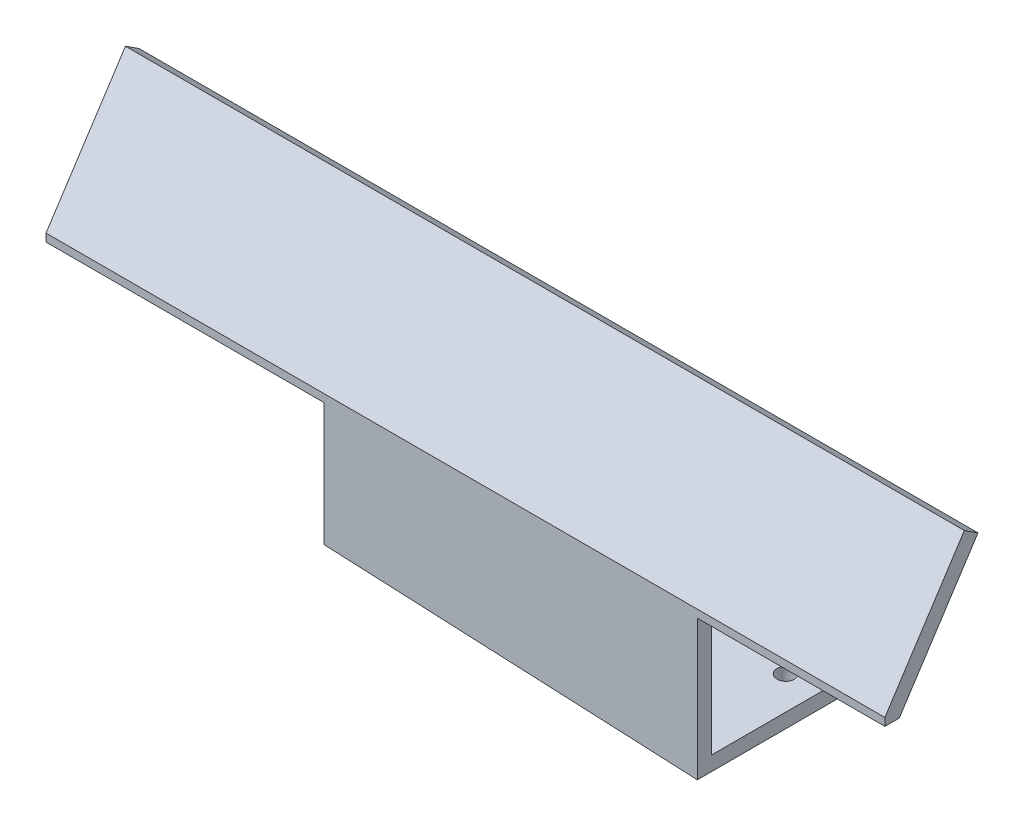
from build123d import *

# Parameters (mm, degrees)
BOSS_EXTRUDE1_DEPTH     = 175
BOSS_EXTRUDE2_DEPTH     = 3
SKETCH3_W               = 175.182761709
SKETCH3_H               = 30
BOSS_EXTRUDE3_DEPTH     = 3
CUT_EXTRUDE2_DEPTH      = 181.792640115
CUT_EXTRUDE2_DEPTH_BACK = 181.792640115
CUT_EXTRUDE3_DEPTH      = 184.561872553
CUT_EXTRUDE3_DEPTH_BACK = 184.561872553
SKETCH6_R               = 1.8
CUT_EXTRUDE4_DEPTH      = 181.463142487
CUT_EXTRUDE4_DEPTH_BACK = 181.463142487
SKETCH7_W               = 17.123749229
SKETCH7_H               = 37.285884773


with BuildPart() as part:
    # Sketch1 → Boss-Extrude1 (new body)
    with BuildSketch(Plane(origin=(0, 0, 0), x_dir=(0, 0, -1), z_dir=(1, 0, 0))):
        Polygon((-8.588191211, -21.709603514), (-8.588191211, -3.209603514), (7.989641648, 22.272457974), (10.839609051, 20.418358247), (-5.588191211, -4.833085652), (-5.588191211, -21.709603514), align=None)
    extrude(amount=BOSS_EXTRUDE1_DEPTH)

    # Sketch2 → Boss-Extrude2 (add)
    with BuildSketch(Plane(origin=(0, 0, 5.588191211), x_dir=(-1, 0, 0), z_dir=(0, 0, -1))):
        Polygon((-175, -4.833085652), (-175, -35.833085652), (0, -27.833085652), (0, -4.833085652), align=None)
    extrude(amount=-BOSS_EXTRUDE2_DEPTH)

    # Sketch3 → Boss-Extrude3 (add)
    with BuildSketch(Plane(origin=(-1.269716182, -27.775041484, 0), x_dir=(0.9989567369115598, -0.045666593687385605, 0), z_dir=(-0.045666593687385605, -0.9989567369115598, 0))):
        with Locations((88.862423069, -6.411808789)):
            Rectangle(SKETCH3_W, SKETCH3_H)
    extrude(amount=-BOSS_EXTRUDE3_DEPTH)

    # Sketch5 → Cut-Extrude2 (cut, two sides: drawn at the far end of the back side and taken through both)
    with BuildSketch(Plane(origin=(0, 0, 5.588191211), x_dir=(-1, 0, 0), z_dir=(0, 0, -1)).offset(-CUT_EXTRUDE2_DEPTH_BACK)):
        Polygon((-153, -31.824238309), (-153, -4.833085652), (-175, -4.833085652), (-175, -32.829952595), align=None)
        Polygon((-153, -39.90576601), (-153, -31.824238309), (-175, -32.829952595), (-175, -4.833085652), (-195.370559552, -4.833085652), (-195.370559552, -39.90576601), align=None)
        Polygon((-0.136999781, -24.836215442), (-58, -27.481381166), (-58, -41.473834752), (0, -41.473834752), (0, -27.833085652), align=None)
        Polygon((0, -4.833085652), (-58, -4.833085652), (-58, -27.481381166), (-0.136999781, -24.836215442), (0, -27.833085652), align=None)
    extrude(amount=CUT_EXTRUDE2_DEPTH + CUT_EXTRUDE2_DEPTH_BACK, mode=Mode.SUBTRACT)

    # Sketch6 → Cut-Extrude3 (cut, two sides: drawn at the far end of the back side and taken through both)
    with BuildSketch(Plane(origin=(-1.132716401, -24.778171273, 0), x_dir=(0.9989567369115598, -0.045666593687385605, 0), z_dir=(0.045666593687385605, 0.9989567369115598, 0)).offset(-CUT_EXTRUDE3_DEPTH_BACK)):
        with Locations(Location((82.969275183, 16.411808789, 0), (0, 0, 180))):
            Circle(SKETCH6_R)
        with Locations((130.518881933, 16.411808789)):
            Circle(SKETCH6_R)
    extrude(amount=CUT_EXTRUDE3_DEPTH + CUT_EXTRUDE3_DEPTH_BACK, mode=Mode.SUBTRACT)

    # Sketch7 → Cut-Extrude4 (cut, two sides: drawn at the far end of the back side and taken through both)
    with BuildSketch(Plane(origin=(0, 0, 5.588191211), x_dir=(-1, 0, 0), z_dir=(0, 0, -1)).offset(-CUT_EXTRUDE4_DEPTH_BACK)):
        with Locations((-144.438125386, -23.476028039)):
            Rectangle(SKETCH7_W, SKETCH7_H)
    extrude(amount=CUT_EXTRUDE4_DEPTH + CUT_EXTRUDE4_DEPTH_BACK, mode=Mode.SUBTRACT)


solid = part.part
